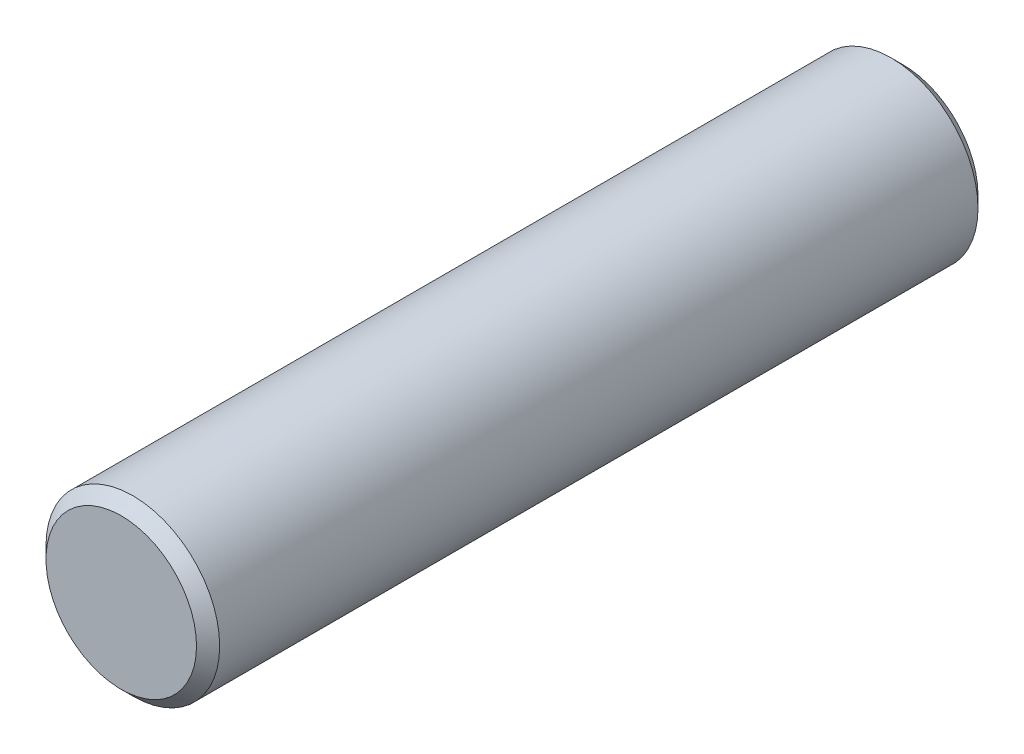
from build123d import *

# Parameters (mm, degrees)
SKETCH1_R           = 1.5
BOSS_EXTRUDE1_DEPTH = 6.75
CHAMFER1_SIZE       = 0.2


with BuildPart() as part:
    # Sketch1 → Boss-Extrude1 (new, symmetric)
    with BuildSketch(Plane.XY):
        Circle(SKETCH1_R)
    extrude(amount=BOSS_EXTRUDE1_DEPTH, both=True)

    # Chamfer1
    chamfer1_edges = [part.edges().sort_by_distance(p)[0] for p in [
        (-1.5, 0, -6.75),
        (-1.5, 0, 6.75),
    ]]
    chamfer(chamfer1_edges, length=CHAMFER1_SIZE)


solid = part.part
